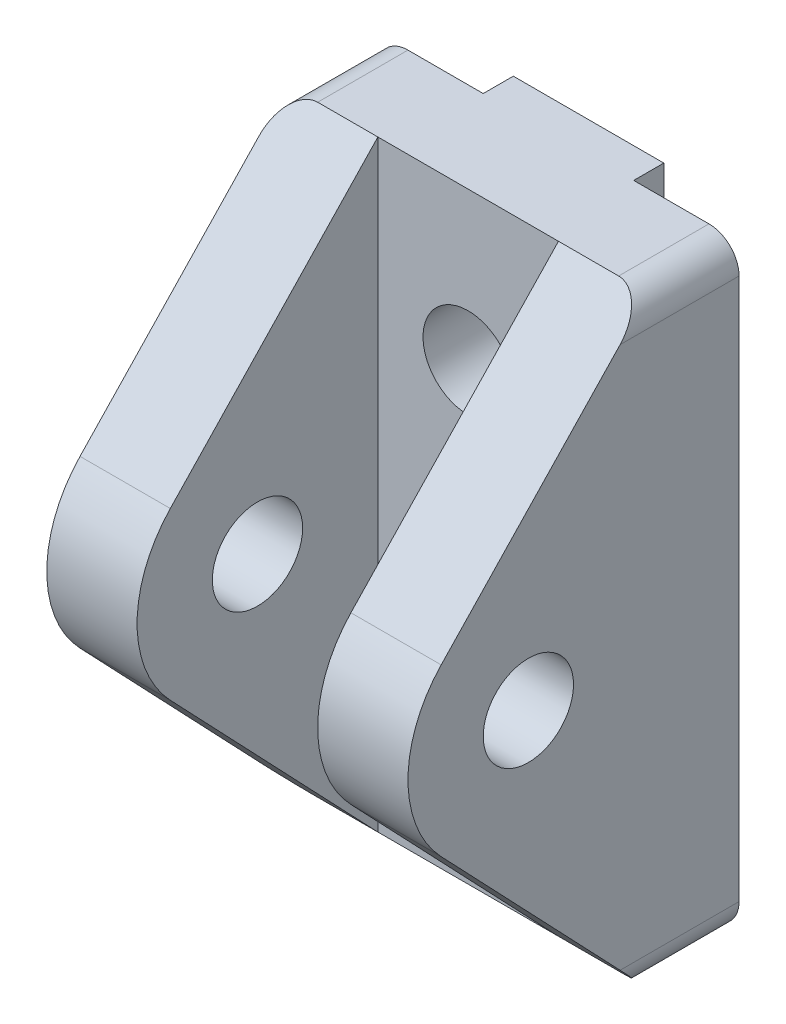
from build123d import *

# Parameters (mm, degrees)
SKETCH1_W           = 12
SKETCH1_H           = 20
SKETCH1_R           = 1.5
BOSS_EXTRUDE1_DEPTH = 3
BOSS_EXTRUDE2_DEPTH = 1
FILLET1_R           = 0.25
BOSS_EXTRUDE3_START = 3
SKETCH4_R           = 1.5
BOSS_EXTRUDE3_DEPTH = 3
FILLET2_R           = 1


with BuildPart() as part:
    # Sketch1 → Boss-Extrude1 (new body)
    with BuildSketch(Plane.XY):
        Rectangle(SKETCH1_W, SKETCH1_H)
        with Locations((0, 5)):
            Circle(SKETCH1_R, mode=Mode.SUBTRACT)
        with Locations((0, -5)):
            Circle(SKETCH1_R, mode=Mode.SUBTRACT)
    extrude(amount=BOSS_EXTRUDE1_DEPTH)

    # Sketch3 → Boss-Extrude2 (add)
    with BuildSketch(Plane(origin=(0, 0, 0), x_dir=(-1, 0, 0), z_dir=(0, 0, -1))):
        with BuildLine():
            Line((-2.5, -10), (2.5, -10))
            Line((2.5, -10), (2.5, -7.449489743))
            ThreePointArc((2.5, -7.449489743), (0, -8.5), (-2.5, -7.449489743))
            Line((-2.5, -7.449489743), (-2.5, -10))
        make_face()
        with BuildLine():
            Line((-2.5, 10), (2.5, 10))
            Line((2.5, 10), (2.5, 7.449489743))
            ThreePointArc((2.5, 7.449489743), (0, 8.5), (-2.5, 7.449489743))
            Line((-2.5, 7.449489743), (-2.5, 10))
        make_face()
        with BuildLine():
            Line((2.5, -2.550510257), (2.5, 2.550510257))
            ThreePointArc((2.5, 2.550510257), (0, 1.5), (-2.5, 2.550510257))
            Line((-2.5, 2.550510257), (-2.5, -2.550510257))
            ThreePointArc((-2.5, -2.550510257), (0, -1.5), (2.5, -2.550510257))
        make_face()
    extrude(amount=BOSS_EXTRUDE2_DEPTH)

    # Fillet1
    fillet1_edges = [part.edges().sort_by_distance(p)[0] for p in [
        (2.5, -7.449489743, -0.5),
        (-2.5, -7.449489743, -0.5),
        (-2.5, 7.449489743, -0.5),
        (2.5, 7.449489743, -0.5),
        (-2.5, 2.550510257, -0.5),
        (2.5, 2.550510257, -0.5),
        (2.5, -2.550510257, -0.5),
        (-2.5, -2.550510257, -0.5),
    ]]
    fillet(fillet1_edges, radius=FILLET1_R)

    # Sketch4 → Boss-Extrude3 (add)
    with BuildSketch(Plane(origin=(0, 0, 0), x_dir=(0, 0, -1), z_dir=(1, 0, 0)).offset(BOSS_EXTRUDE3_START)):
        with BuildLine():
            Line((-3, 10), (-9.896551724, 2.75862069))
            ThreePointArc((-9.896551724, 2.75862069), (-11, 0), (-9.896551724, -2.75862069))
            Line((-9.896551724, -2.75862069), (-3, -10))
            Line((-3, -10), (-3, 10))
        make_face()
        with Locations((-7, 0)):
            Circle(SKETCH4_R, mode=Mode.SUBTRACT)
    boss_extrude3 = extrude(amount=BOSS_EXTRUDE3_DEPTH)

    # Mirror2: Boss-Extrude3 across plane
    add(boss_extrude3.mirror(Plane(origin=(0, 0, 0), x_dir=(0, 0, 1), z_dir=(1, 0, 0))))

    # Fillet2
    fillet2_edges = [part.edges().sort_by_distance(p)[0] for p in [
        (6, -10, 1.5),
        (-6, -10, 1.5),
        (-6, 10, 1.5),
        (6, 10, 1.5),
    ]]
    fillet(fillet2_edges, radius=FILLET2_R)


solid = part.part
